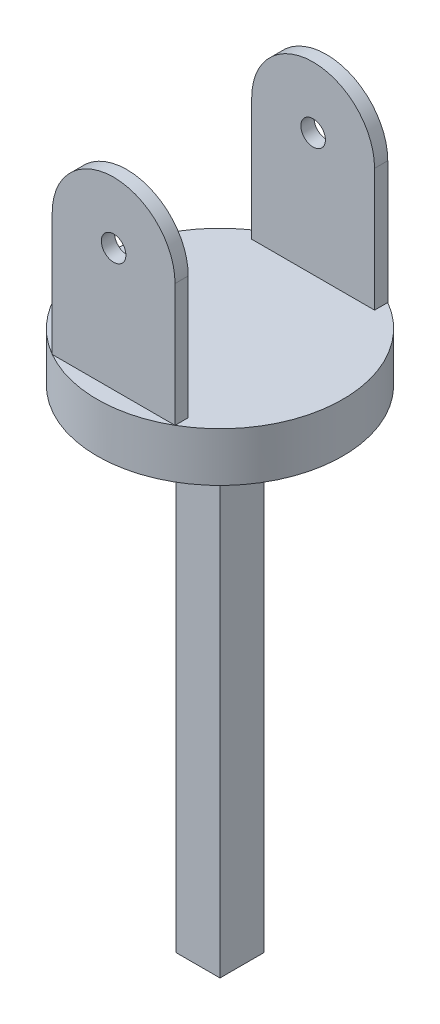
from build123d import *

# Parameters (mm, degrees)
SKETCH2_W           = 3.6
SKETCH2_H           = 3.6
BOSS_EXTRUDE1_DEPTH = 40
SKETCH3_R           = 10
BOSS_EXTRUDE2_DEPTH = 4
SKETCH5_W           = 10
SKETCH5_H           = 1.075357982
BOSS_EXTRUDE3_DEPTH = 15
FILLET3_RADIUS      = 5
FILLET3_LENGTH      = 1.075357982
FILLET4_RADIUS      = 5
FILLET4_LENGTH      = 1.075357982
CUT_EXTRUDE1_REACH  = 64.683
SKETCH6_R           = 1


with BuildPart() as part:
    # Sketch2 → Boss-Extrude1 (new body)
    with BuildSketch(Plane(origin=(0, 0, 0), x_dir=(1, 0, 0), z_dir=(0, 1, 0))):
        Rectangle(SKETCH2_W, SKETCH2_H)
    extrude(amount=BOSS_EXTRUDE1_DEPTH)

    # Sketch3 → Boss-Extrude2 (add)
    with BuildSketch(Plane(origin=(0, 40, 0), x_dir=(1, 0, 0), z_dir=(0, 1, 0))):
        with Locations(Location((0, 0, 0), (0, 0, 270))):
            Circle(SKETCH3_R)
    extrude(amount=BOSS_EXTRUDE2_DEPTH)

    # Sketch5 → Boss-Extrude3 (add)
    with BuildSketch(Plane(origin=(0, 44, 0), x_dir=(1, 0, 0), z_dir=(0, 1, 0))):
        with Locations((0, 8.122575047)):
            Rectangle(SKETCH5_W, SKETCH5_H)
        with Locations((0, -8.122575047)):
            Rectangle(SKETCH5_W, SKETCH5_H)
    extrude(amount=BOSS_EXTRUDE3_DEPTH)

    # Fillet3: full round fillet: the end face becomes a half cylinder, R = half its width
    fillet3_face = Plane((0, 59, 8.122575047), x_dir=(0, 0, -1), z_dir=(0, 1, 0))  # on the end face: x along it, z out of the body
    fillet3_slab = fillet3_face.offset(-FILLET3_RADIUS / 2) * Box(FILLET3_LENGTH, 2 * FILLET3_RADIUS, FILLET3_RADIUS, mode=Mode.PRIVATE)  # the body's end, R deep
    fillet3_round = Plane((0, 54, 8.122575047), x_dir=(0, 1, 0), z_dir=(0, 0, -1)) * Cylinder(FILLET3_RADIUS, FILLET3_LENGTH, mode=Mode.PRIVATE)  # its axis R under the face
    add(fillet3_slab - fillet3_round, mode=Mode.SUBTRACT)

    # Fillet4: full round fillet: the end face becomes a half cylinder, R = half its width
    fillet4_face = Plane((0, 59, -8.122575047), x_dir=(0, 0, 1), z_dir=(0, 1, 0))  # on the end face: x along it, z out of the body
    fillet4_slab = fillet4_face.offset(-FILLET4_RADIUS / 2) * Box(FILLET4_LENGTH, 2 * FILLET4_RADIUS, FILLET4_RADIUS, mode=Mode.PRIVATE)  # the body's end, R deep
    fillet4_round = Plane((0, 54, -8.122575047), x_dir=(0, 1, 0), z_dir=(0, 0, 1)) * Cylinder(FILLET4_RADIUS, FILLET4_LENGTH, mode=Mode.PRIVATE)  # its axis R under the face
    add(fillet4_slab - fillet4_round, mode=Mode.SUBTRACT)

    # Cut-Extrude1: up to this face of the body (flat: up to its plane)
    cut_extrude1_end = Plane(part.part.faces().sort_by_distance((0, 51.008207501, -8.660254038))[0])
    # Sketch6 → Cut-Extrude1 (cut, up to the picked face)
    with BuildSketch(Plane.XY.offset(8.660254038), mode=Mode.PRIVATE) as cut_extrude1_sk1:
        with Locations((0, 54)):
            Circle(SKETCH6_R)
    cut_extrude1_tool1 = split(extrude(cut_extrude1_sk1.sketch, amount=-CUT_EXTRUDE1_REACH, mode=Mode.PRIVATE), bisect_by=cut_extrude1_end, keep=Keep.BOTH, mode=Mode.PRIVATE)
    add(cut_extrude1_tool1.solids().sort_by(Axis((0, 54, 8.660254), (0, 0, -1)))[0], mode=Mode.SUBTRACT)


solid = part.part
